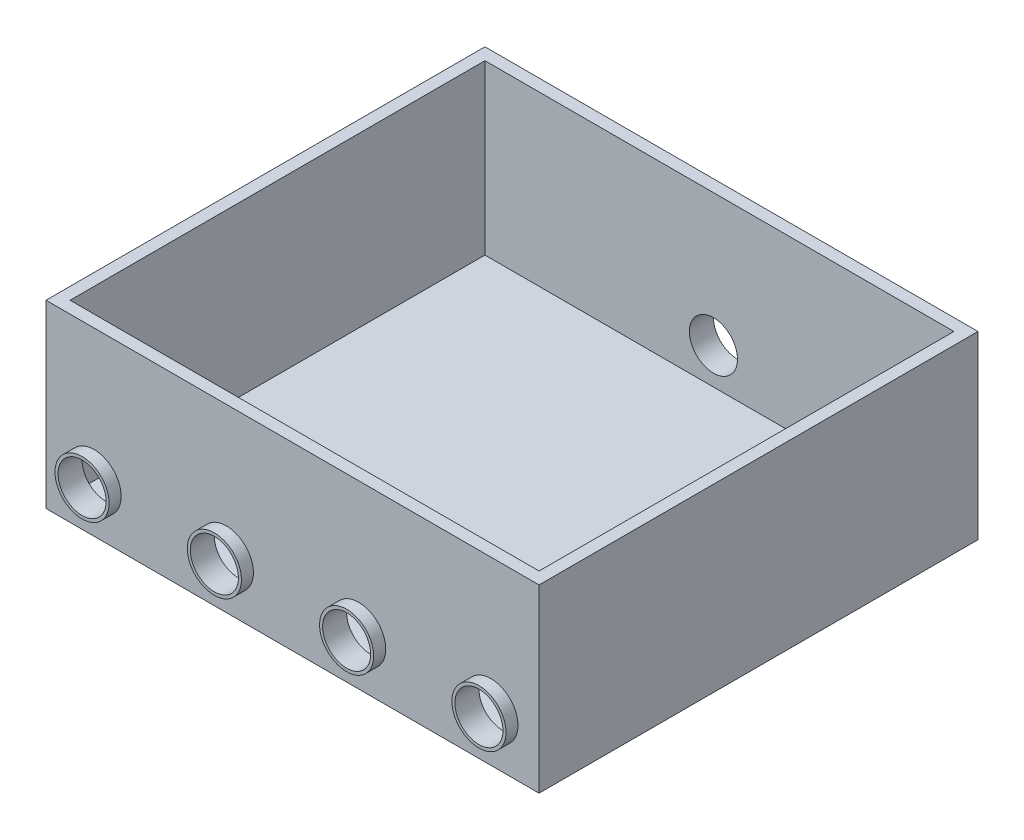
from build123d import *

# Parameters (mm, degrees)
SKETCH1_W           = 1041.4
SKETCH1_H           = 927.1
BOSS_EXTRUDE1_DEPTH = 508
SKETCH3_R           = 57.15
BOSS_EXTRUDE2_DEPTH = 25.4
SKETCH4_R           = 57.15
BOSS_EXTRUDE3_DEPTH = 25.4
SKETCH5_W           = 990.6
SKETCH5_H           = 876.3
CUT_EXTRUDE1_DEPTH  = 482.6
SKETCH6_R           = 50.8
CUT_EXTRUDE2_DEPTH  = 127
SKETCH7_R           = 50.8
CUT_EXTRUDE3_DEPTH  = 127
SKETCH8_W           = 927.1
SKETCH8_H           = 127
CUT_EXTRUDE4_DEPTH  = 1041.4


with BuildPart() as part:
    # Sketch1 → Boss-Extrude1 (new body)
    with BuildSketch(Plane(origin=(0, 0, 0), x_dir=(1, 0, 0), z_dir=(0, 1, 0))):
        with Locations((520.7, 463.55)):
            Rectangle(SKETCH1_W, SKETCH1_H)
    extrude(amount=BOSS_EXTRUDE1_DEPTH)

    # Sketch3 → Boss-Extrude2 (add)
    with BuildSketch(Plane.XY):
        with Locations(Location((101.6, 101.6, 0), (0, 0, 180))):
            Circle(SKETCH3_R)
        with Locations(Location((381, 101.6, 0), (0, 0, 180))):
            Circle(SKETCH3_R)
        with Locations(Location((660.4, 101.6, 0), (0, 0, 180))):
            Circle(SKETCH3_R)
        with Locations(Location((939.8, 101.6, 0), (0, 0, 180))):
            Circle(SKETCH3_R)
    extrude(amount=BOSS_EXTRUDE2_DEPTH)

    # Sketch4 → Boss-Extrude3 (add)
    with BuildSketch(Plane(origin=(0, 0, -927.1), x_dir=(-1, 0, 0), z_dir=(0, 0, -1))):
        with Locations(Location((-508, 101.6, 0), (0, 0, 180))):
            Circle(SKETCH4_R)
    extrude(amount=BOSS_EXTRUDE3_DEPTH)

    # Sketch5 → Cut-Extrude1 (cut)
    with BuildSketch(Plane(origin=(0, 508, 0), x_dir=(1, 0, 0), z_dir=(0, 1, 0))):
        with Locations((520.7, 463.55)):
            Rectangle(SKETCH5_W, SKETCH5_H)
    extrude(amount=-CUT_EXTRUDE1_DEPTH, mode=Mode.SUBTRACT)

    # Sketch6 → Cut-Extrude2 (cut)
    with BuildSketch(Plane.XY.offset(25.4)):
        with Locations((101.6, 101.6)):
            Circle(SKETCH6_R)
        with Locations((381, 101.6)):
            Circle(SKETCH6_R)
        with Locations((660.4, 101.6)):
            Circle(SKETCH6_R)
        with Locations((939.8, 101.6)):
            Circle(SKETCH6_R)
    extrude(amount=-CUT_EXTRUDE2_DEPTH, mode=Mode.SUBTRACT)

    # Sketch7 → Cut-Extrude3 (cut)
    with BuildSketch(Plane(origin=(0, 0, -952.5), x_dir=(-1, 0, 0), z_dir=(0, 0, -1))):
        with Locations((-508, 101.6)):
            Circle(SKETCH7_R)
    extrude(amount=-CUT_EXTRUDE3_DEPTH, mode=Mode.SUBTRACT)

    # Sketch8 → Cut-Extrude4 (cut)
    with BuildSketch(Plane.ZY):
        with Locations((-463.55, 444.5)):
            Rectangle(SKETCH8_W, SKETCH8_H)
    extrude(amount=-CUT_EXTRUDE4_DEPTH, mode=Mode.SUBTRACT)


solid = part.part
